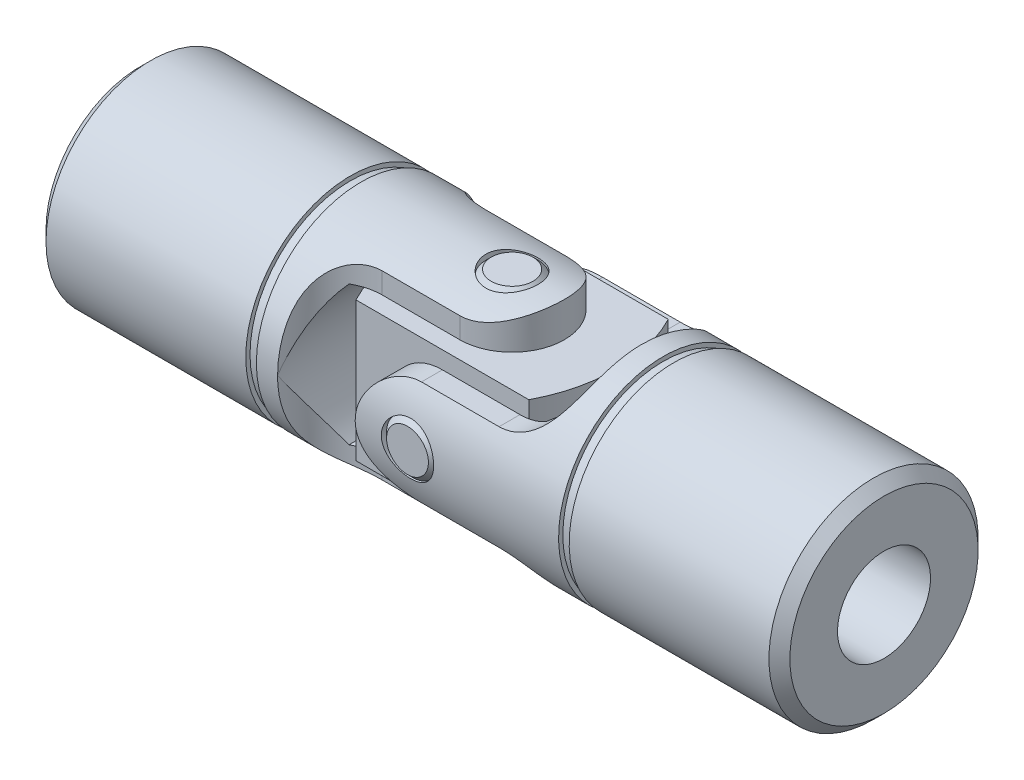
from build123d import *

# Parameters (mm, degrees)
CHAMFER1_SIZE         = 0.714375
EXTRUDE1_DEPTH        = 28.33544088
EXTRUDE1_DEPTH_BACK   = 28.33544088
EXTRUDE3_DEPTH        = 28.335440933
EXTRUDE3_DEPTH_BACK   = 28.335440933
SKETCH4_R             = 3.175
EXTRUDE4_DEPTH        = 14.2875
EXTRUDE6_DEPTH        = 28.335440933
EXTRUDE6_DEPTH_BACK   = 28.335440933
SKETCH6_R             = 1.7859375
BODY_MOVE_COPY1_ANGLE = 90
EXTRUDE10_START       = -4.757738
SKETCH10_W            = 14.1684375
SKETCH10_H            = 9.515475
EXTRUDE10_DEPTH       = 9.515476
CUT_EXTRUDE2_DEPTH    = 29.94544131
EXTRUDE13_DEPTH       = 28.335440933
EXTRUDE13_DEPTH_BACK  = 28.335440933
SKETCH13_R            = 1.7859375
SKETCH14_R            = 1.7859375
EXTRUDE14_DEPTH       = 7.14375
EXTRUDE15_DEPTH       = 28.335440933
EXTRUDE15_DEPTH_BACK  = 28.335440933
SKETCH15_R            = 1.7859375
SKETCH16_R            = 1.7859375
EXTRUDE16_DEPTH       = 7.14375
CHAMFER3_SIZE         = 0.3571875


with BuildPart() as part:
    # Sketch1 → Revolve1 (revolve)
    with BuildSketch(Plane(origin=(0, 0, 0), x_dir=(1, 0, 0), z_dir=(0, 1, 0)), mode=Mode.PRIVATE) as revolve1_sk:
        Polygon((-25.4, 7.14375), (-11.043046875, 7.14375), (-11.043046875, 6.85403125), (-10.31875, 6.85403125), (-10.31875, 7.14375), (3.571875, 7.14375), (3.571875, 0), (-25.4, 0), align=None)
    revolve(revolve1_sk.sketch.rotate(Axis((-25.4, 0, 0), (1, 0, 0)), 180), axis=Axis((-25.4, 0, 0), (1, 0, 0)))

    # Chamfer1
    chamfer1_edges = [part.edges().sort_by_distance(p)[0] for p in [
        (-25.4, 0, -7.14375),
    ]]
    chamfer(chamfer1_edges, length=CHAMFER1_SIZE)

    # Sketch2 → Extrude1 (cut, two sides: drawn at the far end of the back side and taken through both)
    with BuildSketch(Plane(origin=(0, 0, 0), x_dir=(1, 0, 0), z_dir=(0, 1, 0)).offset(-EXTRUDE1_DEPTH_BACK)):
        with BuildLine():
            Line((-8.87015625, 7.14375), (7.14375, 7.14375))
            Line((7.14375, 7.14375), (7.14375, -7.14375))
            Line((7.14375, -7.14375), (-8.87015625, -7.14375))
            ThreePointArc((-8.87015625, -7.14375), (-7.823978284, -4.618052966), (-5.29828125, -3.571875))
            Line((-5.29828125, -3.571875), (0, -3.571875))
            ThreePointArc((0, -3.571875), (3.571875, 0), (0, 3.571875))
            Line((0, 3.571875), (-5.29828125, 3.571875))
            ThreePointArc((-5.29828125, 3.571875), (-7.823978284, 4.618052966), (-8.87015625, 7.14375))
        make_face()
    extrude(amount=EXTRUDE1_DEPTH + EXTRUDE1_DEPTH_BACK, mode=Mode.SUBTRACT)

    # Sketch3 → Extrude3 (cut, two sides: drawn at the far end of the back side and taken through both)
    with BuildSketch(Plane.XY.offset(-EXTRUDE3_DEPTH_BACK)):
        with BuildLine():
            Line((-7.08421875, 4.7577375), (7.14375, 4.7577375))
            Line((7.14375, 4.7577375), (7.14375, -4.7577375))
            Line((7.14375, -4.7577375), (-7.08421875, -4.7577375))
            ThreePointArc((-7.08421875, -4.7577375), (-8.87015625, 0), (-7.08421875, 4.7577375))
        make_face()
    extrude(amount=EXTRUDE3_DEPTH + EXTRUDE3_DEPTH_BACK, mode=Mode.SUBTRACT)

    # Sketch4 → Extrude4 (cut)
    with BuildSketch(Plane.ZY.offset(25.4)):
        Circle(SKETCH4_R)
    extrude(amount=-EXTRUDE4_DEPTH, mode=Mode.SUBTRACT)

    # Extrude5 cone 1 section (through the dimple's axis) → Extrude5 (revolve, cut)
    with BuildSketch(Plane(origin=(-11.1125, 0, 0), x_dir=(0, 0, 1), z_dir=(0, 1, 0))):
        Polygon((0, 0), (3.175, 0), (0, 3.175), align=None)
    revolve(axis=Axis((-11.1125, 0, 0), (1, 0, 0)), mode=Mode.SUBTRACT)

    # Sketch6 → Extrude6 (cut, two sides: drawn at the far end of the back side and taken through both)
    with BuildSketch(Plane(origin=(0, 0, 0), x_dir=(1, 0, 0), z_dir=(0, 1, 0)).offset(-EXTRUDE6_DEPTH_BACK)):
        with Locations(Location((0, 0, 0), (0, 0, 270))):
            Circle(SKETCH6_R)
    extrude(amount=EXTRUDE6_DEPTH + EXTRUDE6_DEPTH_BACK, mode=Mode.SUBTRACT)


with BuildPart() as body_2:
    # Mirror1: mirrored copy
    add(part.part.mirror(Plane(origin=(0, 0, 0), x_dir=(0, 0, 1), z_dir=(1, 0, 0))))


with BuildPart() as body_2_1:
    # Body-Move/Copy1: moved
    add(body_2.part.rotate(Axis((0, 0, 0), (1, 0, 0)), BODY_MOVE_COPY1_ANGLE))


with BuildPart() as body_3:
    # Sketch10 → Extrude10 (new body)
    with BuildSketch(Plane.XY.offset(EXTRUDE10_START)):
        Rectangle(SKETCH10_W, SKETCH10_H)
    extrude(amount=EXTRUDE10_DEPTH)

    # Sketch20 → Cut-Extrude2 (cut, through all)
    with BuildSketch(Plane(origin=(0, 4.7577375, 0), x_dir=(1, 0, 0), z_dir=(0, 1, 0))):
        with BuildLine():
            Line((8.10021875, -5.7737375), (8.10021875, 5.7737375))
            Line((8.10021875, 5.7737375), (5.903515625, 5.7737375))
            Line((5.903515625, 5.7737375), (5.903515625, 4.7577375))
            ThreePointArc((5.903515625, 4.7577375), (7.08421875, 0), (5.903515625, -4.7577375))
            Line((5.903515625, -4.7577375), (5.903515625, -5.7737375))
            Line((5.903515625, -5.7737375), (8.10021875, -5.7737375))
        make_face()
        with BuildLine():
            Line((-8.10021875, 5.7737375), (-8.10021875, -5.7737375))
            Line((-8.10021875, -5.7737375), (-5.903515625, -5.7737375))
            Line((-5.903515625, -5.7737375), (-5.903515625, -4.7577375))
            ThreePointArc((-5.903515625, -4.7577375), (-7.08421875, 0), (-5.903515625, 4.7577375))
            Line((-5.903515625, 4.7577375), (-5.903515625, 5.7737375))
            Line((-5.903515625, 5.7737375), (-8.10021875, 5.7737375))
        make_face()
    extrude(amount=-CUT_EXTRUDE2_DEPTH, mode=Mode.SUBTRACT)

    # Sketch13 → Extrude13 (cut, two sides: drawn at the far end of the back side and taken through both)
    with BuildSketch(Plane(origin=(0, 0, 0), x_dir=(1, 0, 0), z_dir=(0, 1, 0)).offset(-EXTRUDE13_DEPTH_BACK)):
        with Locations(Location((0, 0, 0), (0, 0, 270))):
            Circle(SKETCH13_R)
    extrude(amount=EXTRUDE13_DEPTH + EXTRUDE13_DEPTH_BACK, mode=Mode.SUBTRACT)

    # Sketch15 → Extrude15 (cut, two sides: drawn at the far end of the back side and taken through both)
    with BuildSketch(Plane.XY.offset(-EXTRUDE15_DEPTH_BACK)):
        Circle(SKETCH15_R)
    extrude(amount=EXTRUDE15_DEPTH + EXTRUDE15_DEPTH_BACK, mode=Mode.SUBTRACT)


with BuildPart() as body_4:
    # Sketch14 → Extrude14 (new, symmetric)
    with BuildSketch(Plane(origin=(0, 0, 0), x_dir=(1, 0, 0), z_dir=(0, 1, 0))):
        with Locations(Location((0, 0, 0), (0, 0, 270))):
            Circle(SKETCH14_R)
    extrude(amount=EXTRUDE14_DEPTH, both=True)

    # Sketch16 → Extrude16 (add, symmetric)
    with BuildSketch(Plane.XY):
        Circle(SKETCH16_R)
    extrude(amount=EXTRUDE16_DEPTH, both=True)

    # Chamfer3
    chamfer3_edges = [body_4.edges().sort_by_distance(p)[0] for p in [
        (0, -7.14375, -1.7859375),
        (0, 7.14375, -1.7859375),
        (-1.7859375, 0, -7.14375),
        (-1.7859375, 0, 7.14375),
    ]]
    chamfer(chamfer3_edges, length=CHAMFER3_SIZE)


solid = Compound([part.part, body_2_1.part, body_3.part, body_4.part])
